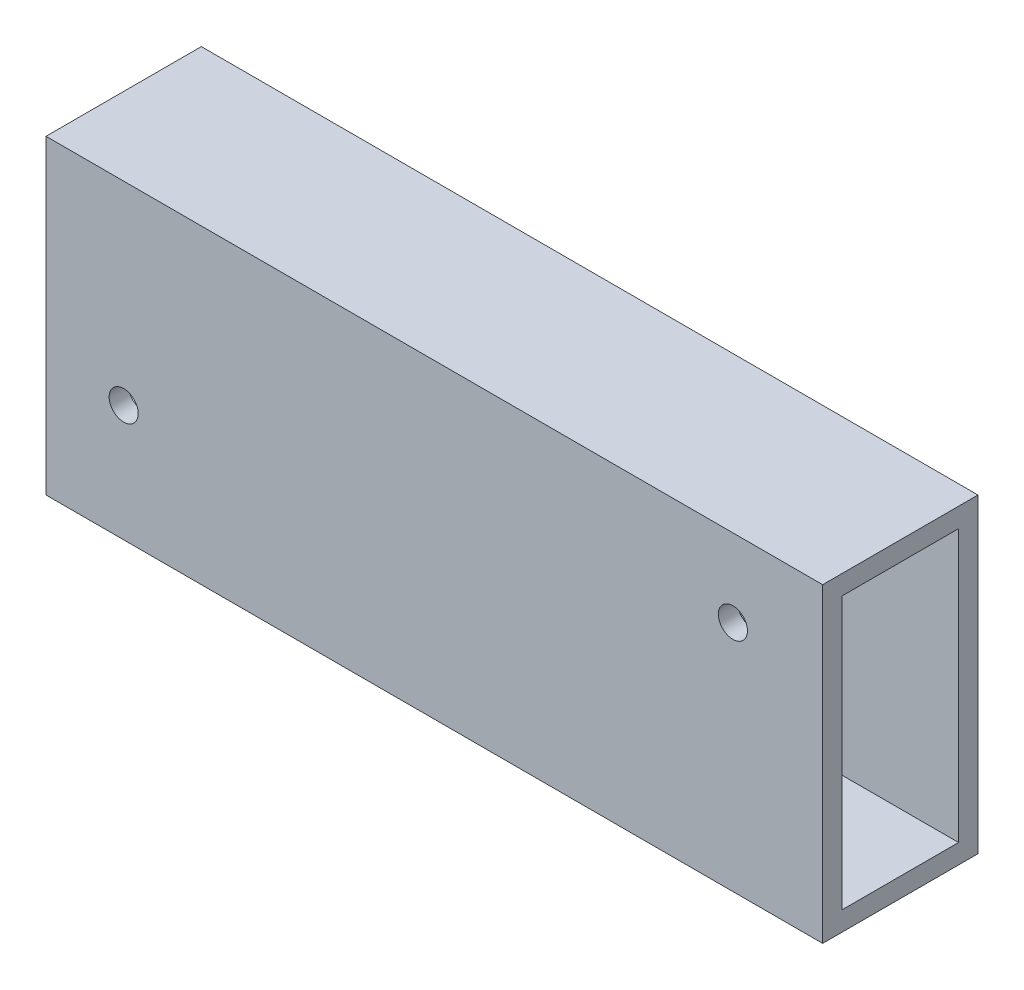
from build123d import *

# Parameters (mm, degrees)
SKETCH2_W           = 25.4
SKETCH2_H           = 50.8
SKETCH2_W_2         = 19.05
SKETCH2_H_2         = 44.45
BOSS_EXTRUDE1_DEPTH = 127
SKETCH4_R           = 2.38125
CUT_EXTRUDE2_DEPTH  = 25.4


with BuildPart() as part:
    # Sketch2 → Boss-Extrude1 (new body)
    with BuildSketch(Plane(origin=(0, 0, 0), x_dir=(0, 0, -1), z_dir=(1, 0, 0))):
        with Locations((-0.932940239, -1.707357918)):
            Rectangle(SKETCH2_W, SKETCH2_H)
        with Locations((-0.932940239, -1.707357918)):
            Rectangle(SKETCH2_W_2, SKETCH2_H_2, mode=Mode.SUBTRACT)
    extrude(amount=BOSS_EXTRUDE1_DEPTH)

    # Sketch4 → Cut-Extrude2 (cut)
    with BuildSketch(Plane.XY.offset(13.632940239)):
        with Locations((12.7, -8.057357918)):
            Circle(SKETCH4_R)
        with Locations((112.320186583, 10.992642082)):
            Circle(SKETCH4_R)
    extrude(amount=-CUT_EXTRUDE2_DEPTH, mode=Mode.SUBTRACT)


solid = part.part
